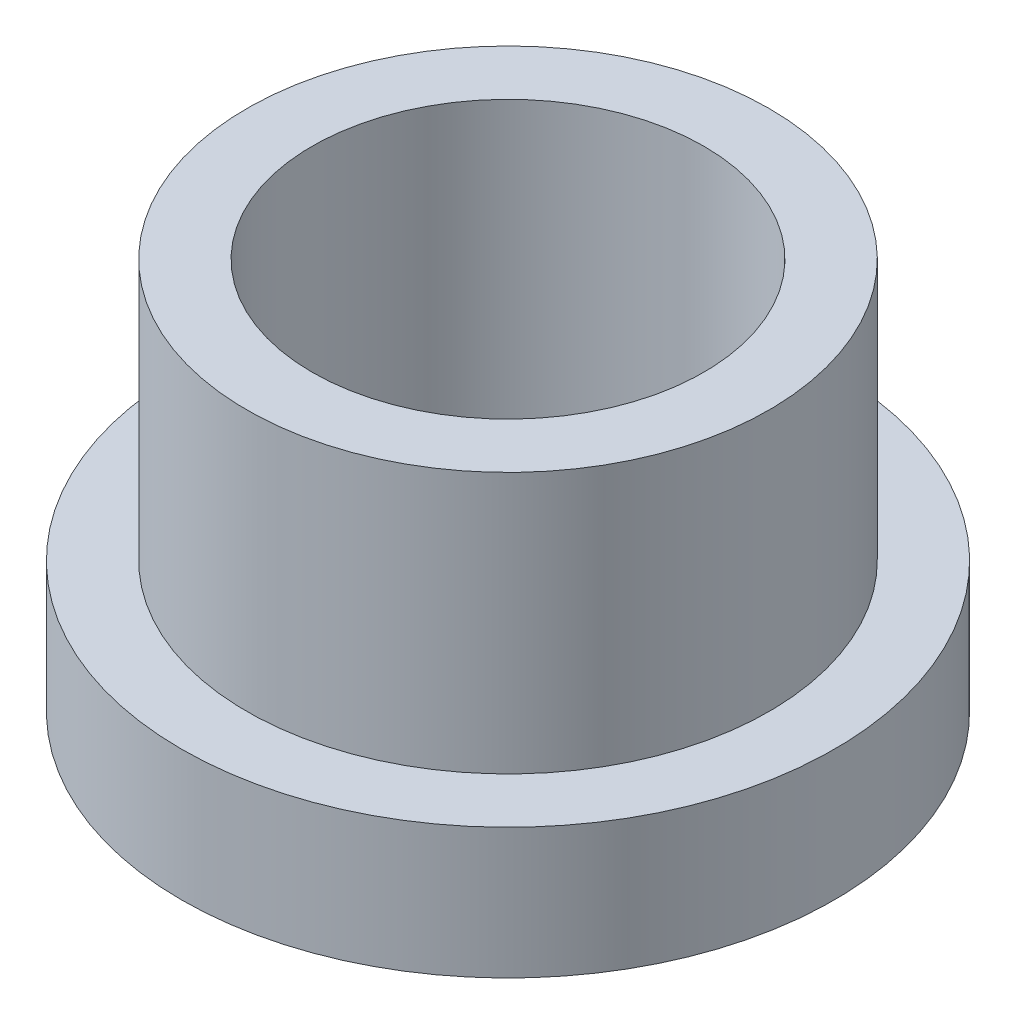
from build123d import *

# Parameters (mm, degrees)
SKETCH2_R           = 7.9375
BOSS_EXTRUDE1_DEPTH = 3.175
SKETCH3_R           = 6.35
BOSS_EXTRUDE2_DEPTH = 6.35
SKETCH4_R           = 4.7625
CUT_EXTRUDE1_DEPTH  = 15.721869362


with BuildPart() as part:
    # Sketch2 → Boss-Extrude1 (new body)
    with BuildSketch(Plane(origin=(0, 0, 0), x_dir=(1, 0, 0), z_dir=(0, 1, 0))):
        with Locations(Location((0, 0, 0), (0, 0, 270))):
            Circle(SKETCH2_R)
    extrude(amount=BOSS_EXTRUDE1_DEPTH)

    # Sketch3 → Boss-Extrude2 (add)
    with BuildSketch(Plane(origin=(0, 3.175, 0), x_dir=(1, 0, 0), z_dir=(0, 1, 0))):
        with Locations(Location((0, 0, 0), (0, 0, 90))):
            Circle(SKETCH3_R)
    extrude(amount=BOSS_EXTRUDE2_DEPTH)

    # Sketch4 → Cut-Extrude1 (cut, through all)
    with BuildSketch(Plane(origin=(0, 9.525, 0), x_dir=(1, 0, 0), z_dir=(0, 1, 0))):
        with Locations(Location((0, 0, 0), (0, 0, 270))):
            Circle(SKETCH4_R)
    extrude(amount=-CUT_EXTRUDE1_DEPTH, mode=Mode.SUBTRACT)


solid = part.part
